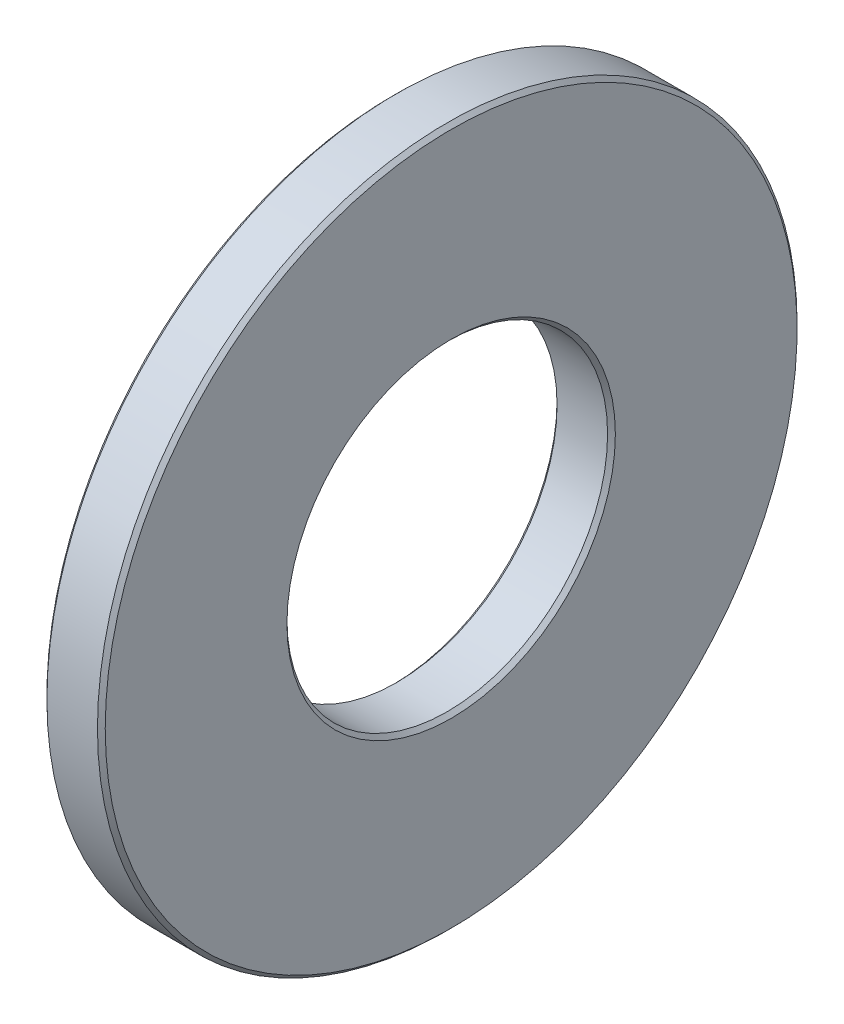
from build123d import *

# Parameters (mm, degrees)
ESQUISSE1_W     = 1.5
ESQUISSE1_H     = 4.875
CHANFREIN1_SIZE = 0.1


with BuildPart() as part:
    # Esquisse1 → Base-Révolution (revolve)
    with BuildSketch(Plane.XY, mode=Mode.PRIVATE) as base_r_volution_sk:
        with Locations((0.75, 6.5625)):
            Rectangle(ESQUISSE1_W, ESQUISSE1_H)
    revolve(base_r_volution_sk.sketch.rotate(Axis((0, 0, 0), (1, 0, 0)), 90), axis=Axis((0, 0, 0), (1, 0, 0)))

    # Chanfrein1
    chanfrein1_edges = [part.edges().sort_by_distance(p)[0] for p in [
        (0, 0, -4.125),
        (1.5, 0, -4.125),
        (1.5, 0, -9),
        (0, 0, -9),
    ]]
    chamfer(chanfrein1_edges, length=CHANFREIN1_SIZE)


solid = part.part
